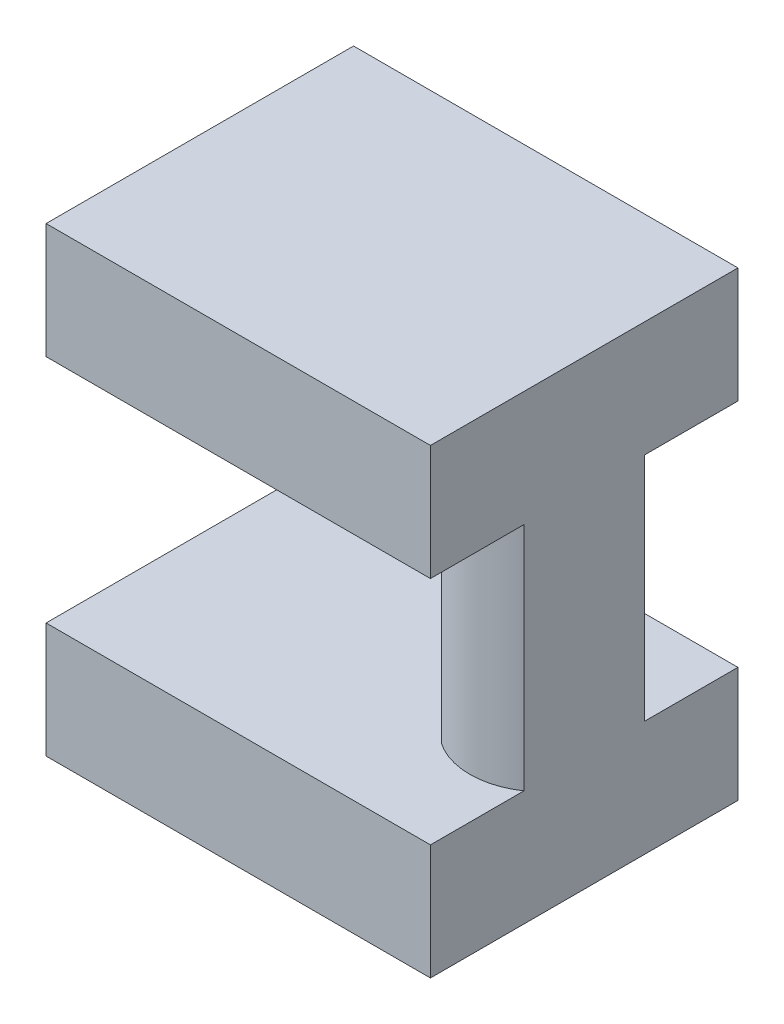
from build123d import *

# Parameters (mm, degrees)
BOSS_EXTRUDE1_DEPTH = 8
SKETCH2_W           = 2.1
SKETCH2_H           = 6
CUT_EXTRUDE1_DEPTH  = 8
CUT_EXTRUDE2_DEPTH  = 6


with BuildPart() as part:
    # Sketch1 → Boss-Extrude1 (new body)
    with BuildSketch(Plane.XY):
        Polygon((0, 9), (0, 12), (10, 12), (10, 0), (0, 0), (0, 3), (7.85, 3), (7.85, 9), align=None)
    extrude(amount=BOSS_EXTRUDE1_DEPTH)

    # Sketch2 → Cut-Extrude1 (cut)
    with BuildSketch(Plane(origin=(10, 0, 0), x_dir=(0, 0, -1), z_dir=(1, 0, 0))):
        with Locations((-6.95, 6)):
            Rectangle(SKETCH2_W, SKETCH2_H)
        with Locations((-1.05, 6)):
            Rectangle(SKETCH2_W, SKETCH2_H)
    extrude(amount=-CUT_EXTRUDE1_DEPTH, mode=Mode.SUBTRACT)

    # Sketch3 → Cut-Extrude2 (cut)
    with BuildSketch(Plane(origin=(0, 3, 0), x_dir=(1, 0, 0), z_dir=(0, 1, 0))):
        with BuildLine():
            Line((10, -2.1), (8.925, -2.1))
            ThreePointArc((8.925, -2.1), (9.487750142, -2.185251456), (10, -2.433355497))
            Line((10, -2.433355497), (10, -2.1))
        make_face()
        with BuildLine():
            Line((8.925, -2.1), (7.85, -2.1))
            Line((7.85, -2.1), (7.85, -2.433355497))
            ThreePointArc((7.85, -2.433355497), (8.362249858, -2.185251456), (8.925, -2.1))
        make_face()
        with BuildLine():
            Line((7.85, -5.566644503), (7.85, -5.9))
            Line((7.85, -5.9), (8.925, -5.9))
            ThreePointArc((8.925, -5.9), (8.362249858, -5.814748544), (7.85, -5.566644503))
        make_face()
        with BuildLine():
            ThreePointArc((10, -5.566644503), (9.487750142, -5.814748544), (8.925, -5.9))
            Line((8.925, -5.9), (10, -5.9))
            Line((10, -5.9), (10, -5.566644503))
        make_face()
    extrude(amount=CUT_EXTRUDE2_DEPTH, mode=Mode.SUBTRACT)


solid = part.part
